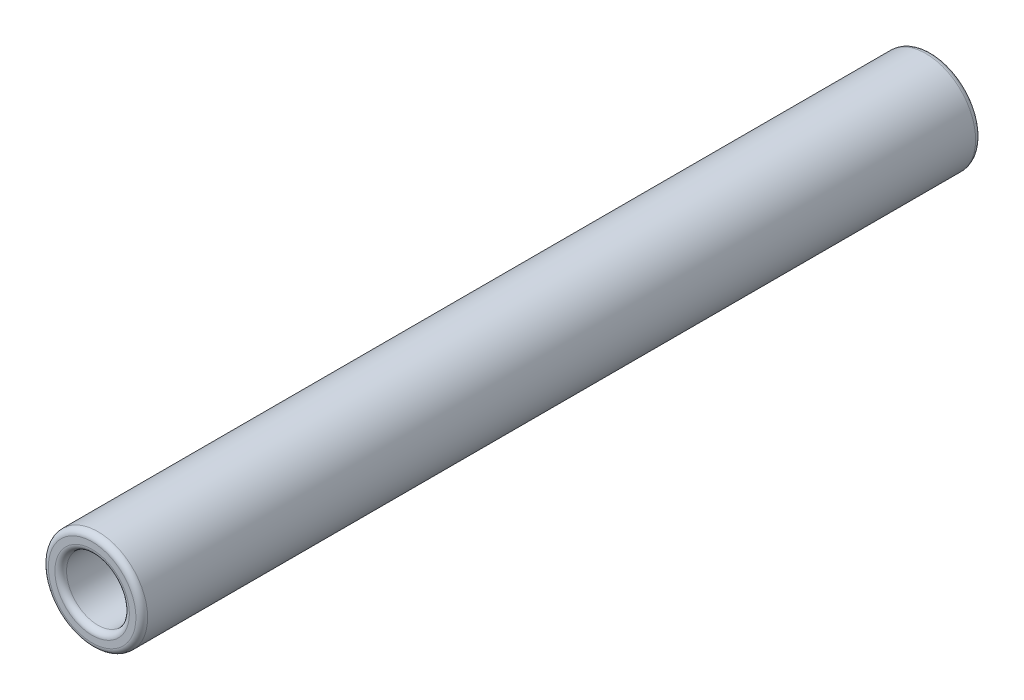
from build123d import *

# Parameters (mm, degrees)
SKETCH2_R           = 8.636
SKETCH2_R_2         = 5.461
BOSS_EXTRUDE1_DEPTH = 146.05
FILLET1_R           = 1.016


with BuildPart() as part:
    # Sketch2 → Boss-Extrude1 (new body)
    with BuildSketch(Plane.XY):
        Circle(SKETCH2_R)
        Circle(SKETCH2_R_2, mode=Mode.SUBTRACT)
    extrude(amount=BOSS_EXTRUDE1_DEPTH)

    # Fillet1
    fillet1_edges = [part.edges().sort_by_distance(p)[0] for p in [
        (-8.636, 0, 0),
        (-8.636, 0, 146.05),
        (-5.461, 0, 0),
        (-5.461, 0, 146.05),
    ]]
    fillet(fillet1_edges, radius=FILLET1_R)


solid = part.part
